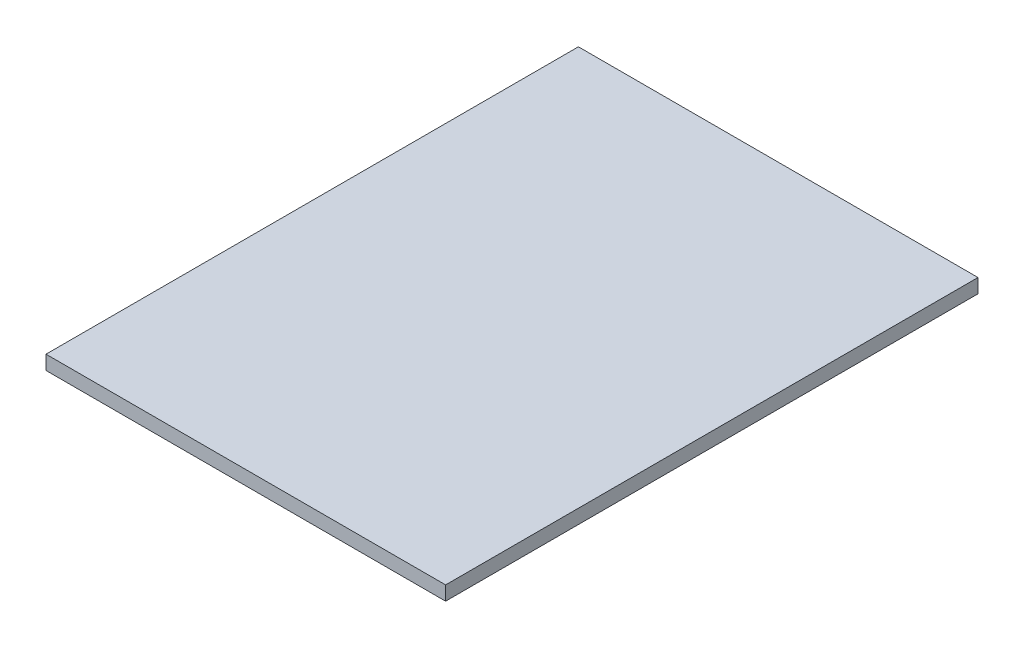
from build123d import *

# Parameters (mm, degrees)
SKETCH1_W           = 325
SKETCH1_H           = 433
BOSS_EXTRUDE1_DEPTH = 11.5


with BuildPart() as part:
    # Sketch1 → Boss-Extrude1 (new body)
    with BuildSketch(Plane(origin=(0, 0, 0), x_dir=(1, 0, 0), z_dir=(0, 1, 0))):
        Rectangle(SKETCH1_W, SKETCH1_H)
    extrude(amount=BOSS_EXTRUDE1_DEPTH)


solid = part.part
